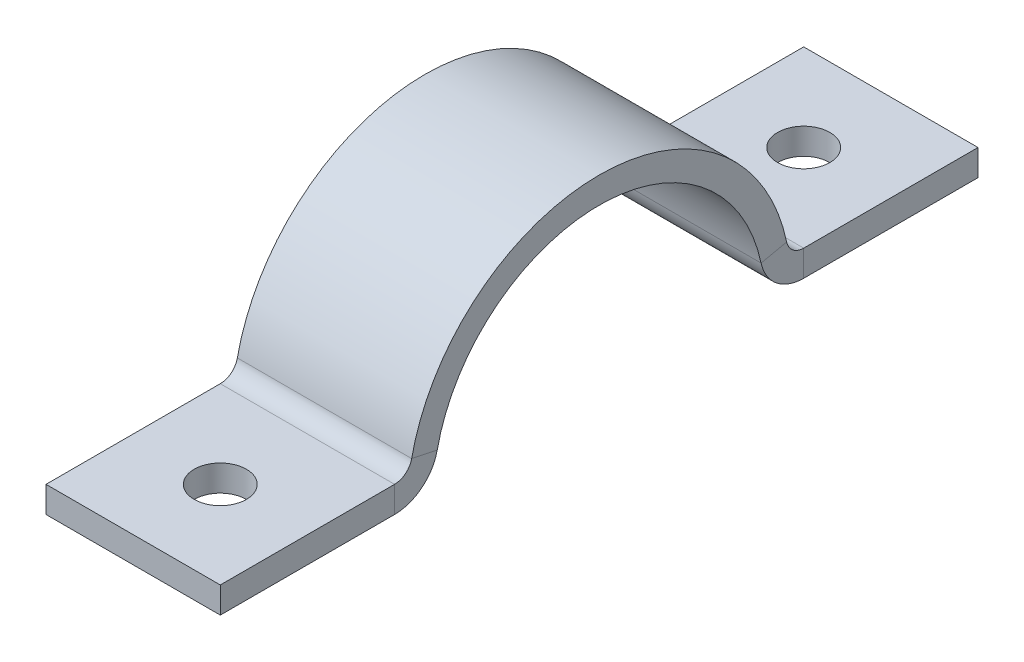
from build123d import *

# Parameters (mm, degrees)
SKETCH8_W          = 20
SKETCH8_H          = 3
SKETCH10_R         = 3
CUT_EXTRUDE1_DEPTH = 50.738672756


with BuildPart() as part:
    # Sweep1: sweep along a path in Sketch7
    with BuildLine(Plane(origin=(0, 0, 0), x_dir=(0, 0, -1), z_dir=(1, 0, 0))) as sweep1_path:
        Line((43.473389189, 0), (23.473389189, 0))
        ThreePointArc((23.473389189, 0), (20.327624841, 1.113592061), (18.583099774, 3.958333333))
        ThreePointArc((18.583099774, 3.958333333), (0, 19), (-18.583099774, 3.958333333))
        ThreePointArc((-18.583099774, 3.958333333), (-20.327624841, 1.113592061), (-23.473389189, 0))
        Line((-23.473389189, 0), (-43.473389189, 0))
    # Sketch8 → Sweep1 (sweep)
    with BuildSketch(Plane.XY.offset(-43.473389189)):
        with Locations((0, 1.5)):
            Rectangle(SKETCH8_W, SKETCH8_H)
    sweep(path=sweep1_path.line)

    # Sketch10 → Cut-Extrude1 (cut, through all)
    with BuildSketch(Plane(origin=(0, 0, 0), x_dir=(-1, 0, 0), z_dir=(0, -1, 0))):
        with Locations(Location((0, 33.473389189, 0), (0, 0, 90))):
            Circle(SKETCH10_R)
        with Locations(Location((0, -33.473389189, 0), (0, 0, 90))):
            Circle(SKETCH10_R)
    extrude(amount=-CUT_EXTRUDE1_DEPTH, mode=Mode.SUBTRACT)


solid = part.part
